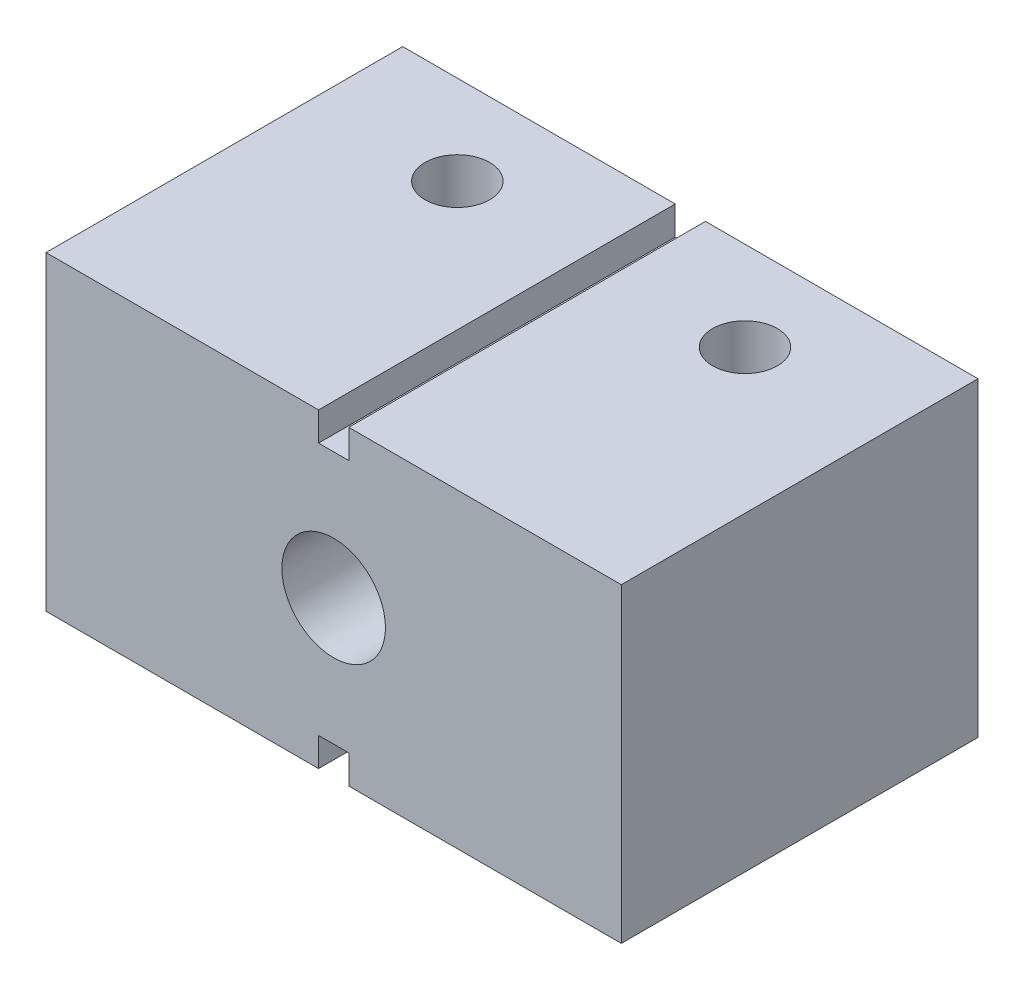
from build123d import *

# Parameters (mm, degrees)
SKETCH1_W           = 40
SKETCH1_H           = 21.6
SKETCH1_R           = 3.6
BOSS_EXTRUDE1_DEPTH = 24.8
CUT_EXTRUDE1_REACH  = 40.492
SKETCH2_R           = 2.25
SKETCH3_W           = 2.1
SKETCH3_H           = 24.8
CUT_EXTRUDE2_DEPTH  = 2
SKETCH4_W           = 2.1
SKETCH4_H           = 24.8
CUT_EXTRUDE3_DEPTH  = 2
CUT_EXTRUDE4_DEPTH  = 1.2


with BuildPart() as part:
    # Sketch1 → Boss-Extrude1 (new body)
    with BuildSketch(Plane.XY):
        Rectangle(SKETCH1_W, SKETCH1_H)
        with Locations(Location((0, 0, 0), (0, 0, 180))):
            Circle(SKETCH1_R, mode=Mode.SUBTRACT)
    extrude(amount=BOSS_EXTRUDE1_DEPTH)

    # Sketch2 → Cut-Extrude1 (cut, up to next)
    with BuildSketch(Plane(origin=(0, 10.8, 0), x_dir=(1, 0, 0), z_dir=(0, 1, 0)), mode=Mode.PRIVATE) as cut_extrude1_sk1:
        with Locations(Location((-10, -6.2, 0), (0, 0, 270))):
            Circle(SKETCH2_R)
    cut_extrude1_tool1 = extrude(cut_extrude1_sk1.sketch, amount=-CUT_EXTRUDE1_REACH, mode=Mode.PRIVATE) & part.part
    # Sketch2 → Cut-Extrude1 (cut, up to next)
    with BuildSketch(Plane(origin=(0, 10.8, 0), x_dir=(1, 0, 0), z_dir=(0, 1, 0)), mode=Mode.PRIVATE) as cut_extrude1_sk2:
        with Locations(Location((10, -6.2, 0), (0, 0, 270))):
            Circle(SKETCH2_R)
    cut_extrude1_tool2 = extrude(cut_extrude1_sk2.sketch, amount=-CUT_EXTRUDE1_REACH, mode=Mode.PRIVATE) & part.part
    add(cut_extrude1_tool1.solids().sort_by_distance((-10, 10.8, 6.2))[0], mode=Mode.SUBTRACT)
    add(cut_extrude1_tool2.solids().sort_by_distance((10, 10.8, 6.2))[0], mode=Mode.SUBTRACT)

    # Sketch3 → Cut-Extrude2 (cut)
    with BuildSketch(Plane(origin=(0, 10.8, 0), x_dir=(1, 0, 0), z_dir=(0, 1, 0))):
        with Locations((0, -12.4)):
            Rectangle(SKETCH3_W, SKETCH3_H)
    extrude(amount=-CUT_EXTRUDE2_DEPTH, mode=Mode.SUBTRACT)

    # Sketch4 → Cut-Extrude3 (cut)
    with BuildSketch(Plane.XZ.offset(10.8)):
        with Locations((0, 12.4)):
            Rectangle(SKETCH4_W, SKETCH4_H)
    extrude(amount=-CUT_EXTRUDE3_DEPTH, mode=Mode.SUBTRACT)

    # Sketch5 → Cut-Extrude4 (cut)
    # profile 1 of 4: a face of its own
    with BuildSketch(Plane(origin=(0, 0, 0), x_dir=(-1, 0, 0), z_dir=(0, 0, -1))):
        Polygon((-11.796693013, -7.110777244), (-11.796693013, -6.349358974), (-8.296693013, -6.349358974), (-8.296693013, -6.798076923), (-11.392846859, -6.798076923), (-11.392846859, -7.336538462), align=None)
    # profile 2 of 4: a face of its own
    with BuildSketch(Plane(origin=(0, 0, 0), x_dir=(-1, 0, 0), z_dir=(0, 0, -1))):
        with BuildLine():
            add(Edge.make_bspline(
                [(-10.221973462, -3.337339744), (-10.209139303, -3.310569467), (-10.183958379, -3.258045548), (-10.14251948, -3.182783944), (-10.098513171, -3.112776733), (-10.051821961, -3.047762395), (-10.003089069, -2.987431171), (-9.951157902, -2.932431575), (-9.895913818, -2.883501755), (-9.839548231, -2.838257605), (-9.7803361, -2.799198714), (-9.719814355, -2.764478144), (-9.657513241, -2.735021293), (-9.593506651, -2.711012891), (-9.527969979, -2.692938504), (-9.461249543, -2.679374079), (-9.39272898, -2.671628609), (-9.34652471, -2.670462234), (-9.323135321, -2.669871795)],
                knots=[0, 0, 0, 0, 1.199852352, 2.35413882, 3.47065844, 4.540274002, 5.587801972, 6.603495342, 7.593560922, 8.568777743, 9.522481312, 10.457521451, 11.387201504, 12.30490139, 13.21713931, 14.132356092, 15.05456678, 16, 16, 16, 16], degree=3))
            add(Edge.make_bspline(
                [(-9.323135321, -2.669871795), (-9.290138084, -2.670620849), (-9.224570496, -2.672109268), (-9.127351862, -2.685899195), (-9.032391056, -2.708483604), (-8.939680998, -2.739371961), (-8.848906805, -2.778918626), (-8.760975531, -2.828240437), (-8.674822483, -2.885835184), (-8.620733307, -2.929998384), (-8.593267532, -2.952423878)],
                knots=[0, 0, 0, 0, 0.989668167, 1.966532972, 2.939463265, 3.915194743, 4.894949873, 5.905734453, 6.936559411, 8, 8, 8, 8], degree=3))
            add(Edge.make_bspline(
                [(-8.593267532, -2.952423878), (-8.562289446, -2.980847606), (-8.500391893, -3.037641274), (-8.422362386, -3.137136721), (-8.354757328, -3.244911895), (-8.300925389, -3.36352948), (-8.257909904, -3.491462679), (-8.228179245, -3.629504314), (-8.210637897, -3.777190102), (-8.208204463, -3.87878994), (-8.206949423, -3.931189904)],
                knots=[0, 0, 0, 0, 0.926996352, 1.852238525, 2.781645049, 3.73067391, 4.721265738, 5.756811539, 6.843078903, 8, 8, 8, 8], degree=3))
            add(Edge.make_bspline(
                [(-8.206949423, -3.931189904), (-8.20809768, -3.979137537), (-8.21032759, -4.072251681), (-8.225492424, -4.207511232), (-8.252224883, -4.333778244), (-8.289148029, -4.45139135), (-8.336948958, -4.56013024), (-8.395535325, -4.660096145), (-8.465261687, -4.750766173), (-8.5447029, -4.831967285), (-8.630492714, -4.902913032), (-8.718385085, -4.96626001), (-8.809088088, -5.018948013), (-8.902119486, -5.061941442), (-8.997171623, -5.095706351), (-9.094421751, -5.120796409), (-9.194188394, -5.134749761), (-9.261396562, -5.136795107), (-9.295090449, -5.137820513)],
                knots=[0, 0, 0, 0, 1.265004079, 2.45663372, 3.584954987, 4.665300477, 5.703324836, 6.712186938, 7.714849438, 8.713389218, 9.702614074, 10.648777578, 11.568864218, 12.465490505, 13.348959921, 14.226816935, 15.111039146, 16, 16, 16, 16], degree=3))
            add(Edge.make_bspline(
                [(-9.295090449, -5.137820513), (-9.319881832, -5.137232341), (-9.368882712, -5.136069801), (-9.441581231, -5.128283083), (-9.512104778, -5.11497852), (-9.581017527, -5.096501138), (-9.648039239, -5.073048741), (-9.712876294, -5.042989025), (-9.776017355, -5.00877782), (-9.837298762, -4.969332362), (-9.896228951, -4.924682211), (-9.951780497, -4.873721957), (-10.004475348, -4.817440416), (-10.054147546, -4.755802221), (-10.100612436, -4.68869594), (-10.144048697, -4.61627477), (-10.184729874, -4.538514921), (-10.208948136, -4.484047527), (-10.22127234, -4.456330128)],
                knots=[0, 0, 0, 0, 0.970998584, 1.919206541, 2.85996215, 3.779229183, 4.711484757, 5.637246212, 6.575281256, 7.522383947, 8.489058119, 9.467492802, 10.471290689, 11.506323461, 12.565206568, 13.665688042, 14.812113961, 16, 16, 16, 16], degree=3))
            add(Edge.make_bspline(
                [(-10.22127234, -4.456330128), (-10.238111181, -4.49433646), (-10.271126397, -4.568853895), (-10.339991583, -4.669054243), (-10.42191297, -4.75595456), (-10.515921539, -4.828925848), (-10.618725862, -4.885787283), (-10.726509226, -4.928168038), (-10.838974973, -4.953339285), (-10.915494214, -4.956663126), (-10.953944615, -4.958333333)],
                knots=[0, 0, 0, 0, 1.055786149, 2.070036037, 3.075322791, 4.083892423, 5.084738157, 6.054218916, 7.022258148, 8, 8, 8, 8], degree=3))
            add(Edge.make_bspline(
                [(-10.953944615, -4.958333333), (-10.993118725, -4.95677113), (-11.071628713, -4.953640271), (-11.188072958, -4.926183921), (-11.302290252, -4.882268218), (-11.413216399, -4.82188178), (-11.518271697, -4.747264885), (-11.611164276, -4.656040071), (-11.693389143, -4.552964295), (-11.762217123, -4.437457762), (-11.81720313, -4.313275646), (-11.857602218, -4.183272638), (-11.882277156, -4.048281642), (-11.88504002, -3.956533472), (-11.886436603, -3.91015625)],
                knots=[0, 0, 0, 0, 0.906232073, 1.81620639, 2.755067393, 3.733488311, 4.733923586, 5.729132781, 6.738430927, 7.779927963, 8.833993065, 9.876600597, 10.92665582, 12, 12, 12, 12], degree=3))
            add(Edge.make_bspline(
                [(-11.886436603, -3.91015625), (-11.884881568, -3.861664068), (-11.881817257, -3.766106636), (-11.85560527, -3.625940261), (-11.813429595, -3.491656802), (-11.75476625, -3.364768159), (-11.682146313, -3.248184184), (-11.598508489, -3.144118004), (-11.503816305, -3.054641595), (-11.398980087, -2.981654002), (-11.289102314, -2.922301241), (-11.175331868, -2.881212893), (-11.06060845, -2.854174129), (-10.983304808, -2.850959117), (-10.944830032, -2.849358974)],
                knots=[0, 0, 0, 0, 1.110208671, 2.1877483, 3.254592481, 4.327866721, 5.381256925, 6.393920549, 7.378769384, 8.35475804, 9.312870313, 10.230979168, 11.119541109, 12, 12, 12, 12], degree=3))
            add(Edge.make_bspline(
                [(-10.944830032, -2.849358974), (-10.906846781, -2.851040096), (-10.831987493, -2.854353336), (-10.72231246, -2.878853712), (-10.618190924, -2.920127929), (-10.520223618, -2.977220018), (-10.429467873, -3.047886471), (-10.349363446, -3.132551883), (-10.27765267, -3.228476846), (-10.240816344, -3.300498509), (-10.221973462, -3.337339744)],
                knots=[0, 0, 0, 0, 0.988899786, 1.948973104, 2.910993775, 3.895630921, 4.893001336, 5.896206921, 6.923846912, 8, 8, 8, 8], degree=3))
        make_face()
        with BuildLine():
            add(Edge.make_bspline(
                [(-11.482590449, -3.927684295), (-11.482241652, -3.947568767), (-11.481554087, -3.986765997), (-11.474476286, -4.044293835), (-11.462257884, -4.099543981), (-11.446270013, -4.152575415), (-11.426249272, -4.203721316), (-11.399464918, -4.251473342), (-11.369678701, -4.297705843), (-11.335537215, -4.341262609), (-11.2970584, -4.380079862), (-11.256284594, -4.414644644), (-11.213379956, -4.44457262), (-11.16760837, -4.468416243), (-11.119310674, -4.486741615), (-11.068831547, -4.500149414), (-11.015880013, -4.507869972), (-10.979910497, -4.509027813), (-10.961656955, -4.509615385)],
                knots=[0, 0, 0, 0, 1.095042298, 2.158600232, 3.186412038, 4.208725755, 5.208081626, 6.204780072, 7.21895422, 8.236392009, 9.246963976, 10.224519195, 11.178039528, 12.122476845, 13.059778917, 14.018500309, 14.994443309, 16, 16, 16, 16], degree=3))
            add(Edge.make_bspline(
                [(-10.961656955, -4.509615385), (-10.943168111, -4.509070287), (-10.906695216, -4.507994973), (-10.852918351, -4.499631361), (-10.801515228, -4.484271993), (-10.751248585, -4.465108355), (-10.703415283, -4.4384835), (-10.65702449, -4.407000073), (-10.612664677, -4.369588896), (-10.571249567, -4.326844887), (-10.532095063, -4.281467155), (-10.498603755, -4.233101268), (-10.470422296, -4.18339587), (-10.446211164, -4.133067842), (-10.427732081, -4.080670563), (-10.415504146, -4.026747143), (-10.40736939, -3.971631128), (-10.406237864, -3.934490686), (-10.405667372, -3.915765224)],
                knots=[0, 0, 0, 0, 0.988185248, 1.949390515, 2.89834022, 3.851801922, 4.818915382, 5.816844422, 6.845348625, 7.91425703, 8.995576874, 10.04563024, 11.052821543, 12.047539407, 13.027398105, 14.015267437, 14.999337865, 16, 16, 16, 16], degree=3))
            add(Edge.make_bspline(
                [(-10.405667372, -3.915765224), (-10.406621219, -3.888826316), (-10.408526611, -3.835013521), (-10.423565383, -3.755773928), (-10.448655471, -3.678917059), (-10.482545826, -3.605335888), (-10.525205301, -3.536824764), (-10.575083492, -3.474991681), (-10.633056114, -3.422214848), (-10.696933345, -3.378514067), (-10.763495046, -3.342498317), (-10.831822973, -3.317526694), (-10.900082386, -3.300716541), (-10.945902713, -3.298953083), (-10.968668173, -3.298076923)],
                knots=[0, 0, 0, 0, 1.049057894, 2.095583739, 3.129316217, 4.192621495, 5.243692748, 6.26617574, 7.278021799, 8.285803791, 9.275614543, 10.217703439, 11.114480347, 12, 12, 12, 12], degree=3))
            add(Edge.make_bspline(
                [(-10.968668173, -3.298076923), (-11.000019564, -3.299858116), (-11.062803753, -3.303425126), (-11.154134486, -3.336399063), (-11.242032528, -3.386673495), (-11.309506946, -3.444624703), (-11.359642226, -3.499400731), (-11.3926366, -3.546872098), (-11.420815483, -3.59877246), (-11.4431817, -3.655908135), (-11.461366225, -3.717057771), (-11.47410644, -3.783265526), (-11.480677647, -3.853931928), (-11.481941575, -3.9026655), (-11.482590449, -3.927684295)],
                knots=[0, 0, 0, 0, 1.240891064, 2.485004192, 3.810825972, 5.246005007, 5.995001394, 6.754385943, 7.534904256, 8.334385291, 9.185808003, 10.064745552, 11.006480914, 12, 12, 12, 12], degree=3))
        make_face(mode=Mode.SUBTRACT)
        with BuildLine():
            add(Edge.make_bspline(
                [(-10.001821218, -3.908052885), (-10.001116596, -3.934261767), (-9.999721281, -3.986161451), (-9.98958071, -4.062375096), (-9.974006181, -4.136165695), (-9.949190932, -4.206306975), (-9.920470073, -4.274705456), (-9.883308825, -4.339368109), (-9.840475663, -4.40156218), (-9.790936979, -4.459807983), (-9.737105313, -4.513229428), (-9.679542632, -4.560143475), (-9.619584576, -4.600147899), (-9.556337284, -4.632816591), (-9.490535193, -4.658204334), (-9.421494821, -4.675445387), (-9.350190211, -4.687360713), (-9.301450198, -4.68851848), (-9.276861282, -4.689102564)],
                knots=[0, 0, 0, 0, 1.061897617, 2.102804347, 3.111672779, 4.112102386, 5.113293953, 6.114261473, 7.128451447, 8.170219712, 9.208364724, 10.198019986, 11.175268719, 12.124198868, 13.077609243, 14.026397567, 15.004334584, 16, 16, 16, 16], degree=3))
            add(Edge.make_bspline(
                [(-9.276861282, -4.689102564), (-9.245907371, -4.687933982), (-9.184576975, -4.685618618), (-9.094960428, -4.665749844), (-9.0087651, -4.634917556), (-8.928056845, -4.590605724), (-8.853930066, -4.536000242), (-8.788164103, -4.473074029), (-8.733372631, -4.40063402), (-8.688466969, -4.320372501), (-8.653495875, -4.23212498), (-8.628197444, -4.136865389), (-8.613450873, -4.034482867), (-8.611697425, -3.963957517), (-8.610795577, -3.927684295)],
                knots=[0, 0, 0, 0, 0.9814525, 1.944596565, 2.899679746, 3.878886998, 4.855139527, 5.815164808, 6.757283047, 7.727088608, 8.725770639, 9.762198929, 10.849034367, 12, 12, 12, 12], degree=3))
            add(Edge.make_bspline(
                [(-8.610795577, -3.927684295), (-8.611484676, -3.897273993), (-8.612829493, -3.837926482), (-8.622803821, -3.75163874), (-8.638696487, -3.670106285), (-8.661987723, -3.593646891), (-8.691264599, -3.52151542), (-8.728048036, -3.454694127), (-8.770969077, -3.392599233), (-8.820069277, -3.335914666), (-8.873602604, -3.285513256), (-8.929450679, -3.240654278), (-8.987296882, -3.20275684), (-9.047835533, -3.172206317), (-9.110385115, -3.148462731), (-9.174830326, -3.130562719), (-9.241736806, -3.12074493), (-9.286880838, -3.119315761), (-9.309814006, -3.118589744)],
                knots=[0, 0, 0, 0, 1.222281775, 2.385355485, 3.487203028, 4.557186295, 5.593560507, 6.611067706, 7.617058548, 8.622873886, 9.619741804, 10.569077626, 11.499394282, 12.39435997, 13.28947359, 14.185178695, 15.078070757, 16, 16, 16, 16], degree=3))
            add(Edge.make_bspline(
                [(-9.309814006, -3.118589744), (-9.331838015, -3.119178311), (-9.375710101, -3.120350744), (-9.440224323, -3.132409086), (-9.503446096, -3.149622659), (-9.564803412, -3.175267661), (-9.624372811, -3.208386568), (-9.682121455, -3.248598297), (-9.737675593, -3.296105183), (-9.790973053, -3.349467041), (-9.840699788, -3.407605481), (-9.883317735, -3.470452588), (-9.920276236, -3.535656503), (-9.949506891, -3.60454394), (-9.973970795, -3.675773099), (-9.989518546, -3.750707005), (-9.999793225, -3.82830671), (-10.001136855, -3.881141862), (-10.001821218, -3.908052885)],
                knots=[0, 0, 0, 0, 0.909659226, 1.812051987, 2.705396151, 3.615260672, 4.55387093, 5.51892194, 6.519929187, 7.572237699, 8.635098036, 9.677778311, 10.707435555, 11.728897661, 12.767899407, 13.81607327, 14.887640164, 16, 16, 16, 16], degree=3))
        make_face(mode=Mode.SUBTRACT)
    # profile 3 of 4: a face of its own
    with BuildSketch(Plane(origin=(0, 0, 0), x_dir=(-1, 0, 0), z_dir=(0, 0, -1))):
        with BuildLine():
            Line((-10.899257115, -0.78525641), (-10.899257115, -0.336538462))
            Line((-10.899257115, -0.336538462), (-10.462458237, -0.336538462))
            add(Edge.make_bspline(
                [(-10.462458237, -0.336538462), (-10.481254419, -0.332228906), (-10.517928783, -0.323820274), (-10.570264571, -0.305304283), (-10.618659937, -0.282683929), (-10.664271272, -0.256938569), (-10.705329375, -0.225653829), (-10.743912506, -0.191432773), (-10.777434348, -0.151813781), (-10.796912476, -0.123110334), (-10.806709038, -0.108673878)],
                knots=[0, 0, 0, 0, 1.08898891, 2.124791909, 3.129224238, 4.105481065, 5.077441123, 6.040388005, 7.014409297, 8, 8, 8, 8], degree=3))
            add(Edge.make_bspline(
                [(-10.806709038, -0.108673878), (-10.827995774, -0.065220291), (-10.870025652, 0.020577224), (-10.911775694, 0.156274887), (-10.939592038, 0.293562365), (-10.942614414, 0.386181311), (-10.94412891, 0.432592147)],
                knots=[0, 0, 0, 0, 1.028471117, 2.030678542, 3.013184023, 4, 4, 4, 4], degree=3))
            add(Edge.make_bspline(
                [(-10.94412891, 0.432592147), (-10.943258392, 0.466773107), (-10.941532088, 0.534556582), (-10.925437494, 0.634922913), (-10.89956614, 0.73239989), (-10.863859848, 0.82606818), (-10.820048596, 0.913451078), (-10.770543805, 0.993233652), (-10.714422948, 1.06346164), (-10.652975304, 1.125038055), (-10.584083874, 1.176203873), (-10.508647318, 1.216551381), (-10.42572553, 1.245174983), (-10.367532305, 1.254915519), (-10.337658558, 1.259915865)],
                knots=[0, 0, 0, 0, 1.099015544, 2.179432478, 3.260947688, 4.338981182, 5.398181099, 6.40160478, 7.353922011, 8.284349489, 9.192639792, 10.104191918, 11.026778618, 12, 12, 12, 12], degree=3))
            add(Edge.make_bspline(
                [(-10.337658558, 1.259915865), (-10.360680398, 1.268014601), (-10.406203908, 1.284029082), (-10.471788094, 1.313313771), (-10.533002919, 1.348788048), (-10.590666323, 1.388904846), (-10.64513327, 1.433673519), (-10.694507773, 1.484690584), (-10.741545279, 1.539342047), (-10.782777914, 1.599609729), (-10.820602081, 1.662298924), (-10.853576567, 1.7269834), (-10.881836521, 1.792688974), (-10.904042731, 1.859945135), (-10.92273276, 1.927888477), (-10.935303752, 1.997568999), (-10.9421482, 2.068405079), (-10.943467411, 2.115971975), (-10.94412891, 2.139823718)],
                knots=[0, 0, 0, 0, 1.024672991, 2.026193794, 3.01103273, 3.991165591, 4.973850373, 5.96628909, 6.969107479, 7.9982829, 9.028393851, 10.042340945, 11.044967205, 12.028827566, 13.014448664, 14.002022455, 14.998142625, 16, 16, 16, 16], degree=3))
            add(Edge.make_bspline(
                [(-10.94412891, 2.139823718), (-10.943811958, 2.164150027), (-10.943188853, 2.211973905), (-10.935671015, 2.282427493), (-10.924828875, 2.350701399), (-10.908498214, 2.416461513), (-10.888303462, 2.480124101), (-10.862721949, 2.541084669), (-10.833603927, 2.600264962), (-10.787570185, 2.674422482), (-10.722586814, 2.760250435), (-10.629980596, 2.848017145), (-10.526610053, 2.921306637), (-10.430355226, 2.968964978), (-10.345871365, 2.999320508), (-10.274958075, 3.019717854), (-10.19685411, 3.036110066), (-10.111982925, 3.050297442), (-10.019738766, 3.060469013), (-9.920589108, 3.067997783), (-9.81420873, 3.07318971), (-9.74101047, 3.073537849), (-9.703143333, 3.073717949)],
                knots=[0, 0, 0, 0, 0.823332918, 1.618616861, 2.396586156, 3.162386254, 3.910649777, 4.655726331, 5.398909421, 6.1412916, 7.608533871, 9.030212322, 10.444139297, 11.884503253, 12.650507755, 13.48205207, 14.380733726, 15.351243431, 16.394668736, 17.521733916, 18.717936206, 20, 20, 20, 20], degree=3))
            Line((-9.703143333, 3.073717949), (-8.296693013, 3.073717949))
            Line((-8.296693013, 3.073717949), (-8.296693013, 2.625))
            Line((-8.296693013, 2.625), (-9.70174109, 2.625))
            add(Edge.make_bspline(
                [(-9.70174109, 2.625), (-9.733060554, 2.624943821), (-9.793142877, 2.624836048), (-9.879163541, 2.621874148), (-9.957239077, 2.617713708), (-10.027442399, 2.612467552), (-10.089875837, 2.604714797), (-10.144615475, 2.595667342), (-10.191710833, 2.585798641), (-10.243196469, 2.568798611), (-10.299467422, 2.542233989), (-10.35959579, 2.500751636), (-10.412413403, 2.449707016), (-10.458145994, 2.390106135), (-10.494533967, 2.32233864), (-10.521621568, 2.248088902), (-10.536916668, 2.167085006), (-10.539138583, 2.111140367), (-10.540282756, 2.082331731)],
                knots=[0, 0, 0, 0, 1.305595988, 2.50461634, 3.587666171, 4.565077188, 5.438800553, 6.209235777, 6.878175067, 7.442006767, 8.466179135, 9.460727197, 10.473669419, 11.516214057, 12.579940716, 13.667887689, 14.799081087, 16, 16, 16, 16], degree=3))
            add(Edge.make_bspline(
                [(-10.540282756, 2.082331731), (-10.538806528, 2.050172886), (-10.535848027, 1.985723529), (-10.511503084, 1.891113072), (-10.47316402, 1.799404852), (-10.419893854, 1.712063965), (-10.352685597, 1.631632232), (-10.272642636, 1.560437941), (-10.179102603, 1.501687471), (-10.09215158, 1.460202068), (-10.012649235, 1.433419397), (-9.942164422, 1.416508462), (-9.862262483, 1.400730981), (-9.772236629, 1.38967139), (-9.672479786, 1.379301941), (-9.562727465, 1.373861271), (-9.443066843, 1.369210847), (-9.360066988, 1.368802491), (-9.316825224, 1.368589744)],
                knots=[0, 0, 0, 0, 0.965918169, 1.935791113, 2.918614482, 3.946728758, 4.999527746, 6.059992734, 7.153658271, 8.310614728, 8.948450525, 9.672867845, 10.488828659, 11.396296474, 12.399093975, 13.50428262, 14.699766169, 16, 16, 16, 16], degree=3))
            Line((-9.316825224, 1.368589744), (-8.296693013, 1.368589744))
            Line((-8.296693013, 1.368589744), (-8.296693013, 0.919871795))
            Line((-8.296693013, 0.919871795), (-9.616905353, 0.919871795))
            add(Edge.make_bspline(
                [(-9.616905353, 0.919871795), (-9.652197643, 0.919818108), (-9.719756655, 0.919715336), (-9.816524849, 0.916732275), (-9.904183696, 0.912612076), (-9.983017624, 0.907306379), (-10.05271427, 0.899700824), (-10.113502559, 0.890506882), (-10.165281576, 0.880790494), (-10.221077388, 0.863821517), (-10.282208638, 0.837870141), (-10.347041093, 0.796261859), (-10.404107254, 0.744679031), (-10.453052143, 0.684554785), (-10.492650508, 0.616565861), (-10.519858428, 0.541467734), (-10.537376235, 0.46074255), (-10.539295872, 0.404642361), (-10.540282756, 0.375801282)],
                knots=[0, 0, 0, 0, 1.376758737, 2.635489419, 3.77647752, 4.80022883, 5.717469035, 6.510473873, 7.19888343, 7.770014609, 8.782826871, 9.779297374, 10.760594766, 11.771599753, 12.792790105, 13.814021158, 14.876189361, 16, 16, 16, 16], degree=3))
            add(Edge.make_bspline(
                [(-10.540282756, 0.375801282), (-10.538657887, 0.345073774), (-10.535393175, 0.283335583), (-10.513054609, 0.191702679), (-10.47449279, 0.102656922), (-10.424212986, 0.015081744), (-10.35834883, -0.065732195), (-10.279282974, -0.137710489), (-10.187177433, -0.198690187), (-10.100763637, -0.240913005), (-10.023154366, -0.26866124), (-9.956200841, -0.286389334), (-9.881929978, -0.302839556), (-9.799654901, -0.314950456), (-9.709846862, -0.324745123), (-9.612317625, -0.331567904), (-9.507101036, -0.335808637), (-9.434384334, -0.336289574), (-9.396753109, -0.336538462)],
                knots=[0, 0, 0, 0, 0.973894388, 1.956763917, 2.96941869, 4.041797769, 5.147885003, 6.25966368, 7.418502335, 8.637782007, 9.298570163, 10.028234491, 10.831780649, 11.70874194, 12.662651334, 13.69505766, 14.807181832, 16, 16, 16, 16], degree=3))
            Line((-9.396753109, -0.336538462), (-8.296693013, -0.336538462))
            Line((-8.296693013, -0.336538462), (-8.296693013, -0.78525641))
            Line((-8.296693013, -0.78525641), (-10.899257115, -0.78525641))
        make_face()
    # profile 4 of 4: a face of its own
    with BuildSketch(Plane(origin=(0, 0, 0), x_dir=(-1, 0, 0), z_dir=(0, 0, -1))):
        with BuildLine():
            Line((-10.899257115, 3.791666667), (-10.899257115, 4.240384615))
            Line((-10.899257115, 4.240384615), (-10.462458237, 4.240384615))
            add(Edge.make_bspline(
                [(-10.462458237, 4.240384615), (-10.481254419, 4.244694171), (-10.517928783, 4.253102803), (-10.570264571, 4.271618794), (-10.618659937, 4.294239147), (-10.664271272, 4.319984508), (-10.705329375, 4.351269248), (-10.743912506, 4.385490304), (-10.777434348, 4.425109296), (-10.796912476, 4.453812743), (-10.806709038, 4.468249199)],
                knots=[0, 0, 0, 0, 1.08898891, 2.124791909, 3.129224238, 4.105481065, 5.077441123, 6.040388005, 7.014409297, 8, 8, 8, 8], degree=3))
            add(Edge.make_bspline(
                [(-10.806709038, 4.468249199), (-10.827995774, 4.511702786), (-10.870025652, 4.597500301), (-10.911775694, 4.733197964), (-10.939592038, 4.870485442), (-10.942614414, 4.963104388), (-10.94412891, 5.009515224)],
                knots=[0, 0, 0, 0, 1.028471117, 2.030678542, 3.013184023, 4, 4, 4, 4], degree=3))
            add(Edge.make_bspline(
                [(-10.94412891, 5.009515224), (-10.943258392, 5.043696184), (-10.941532088, 5.111479659), (-10.925437494, 5.21184599), (-10.89956614, 5.309322967), (-10.863859848, 5.402991257), (-10.820048596, 5.490374155), (-10.770543805, 5.570156729), (-10.714422948, 5.640384717), (-10.652975304, 5.701961132), (-10.584083874, 5.75312695), (-10.508647318, 5.793474458), (-10.42572553, 5.82209806), (-10.367532305, 5.831838596), (-10.337658558, 5.836838942)],
                knots=[0, 0, 0, 0, 1.099015544, 2.179432478, 3.260947688, 4.338981182, 5.398181099, 6.40160478, 7.353922011, 8.284349489, 9.192639792, 10.104191918, 11.026778618, 12, 12, 12, 12], degree=3))
            add(Edge.make_bspline(
                [(-10.337658558, 5.836838942), (-10.360680398, 5.844937677), (-10.406203908, 5.860952159), (-10.471788094, 5.890236847), (-10.533002919, 5.925711125), (-10.590666323, 5.965827923), (-10.64513327, 6.010596596), (-10.694507773, 6.061613661), (-10.741545279, 6.116265124), (-10.782777914, 6.176532806), (-10.820602081, 6.239222001), (-10.853576567, 6.303906477), (-10.881836521, 6.369612051), (-10.904042731, 6.436868212), (-10.92273276, 6.504811554), (-10.935303752, 6.574492076), (-10.9421482, 6.645328155), (-10.943467411, 6.692895052), (-10.94412891, 6.716746795)],
                knots=[0, 0, 0, 0, 1.024672991, 2.026193794, 3.01103273, 3.991165591, 4.973850373, 5.96628909, 6.969107479, 7.9982829, 9.028393851, 10.042340945, 11.044967205, 12.028827566, 13.014448664, 14.002022455, 14.998142625, 16, 16, 16, 16], degree=3))
            add(Edge.make_bspline(
                [(-10.94412891, 6.716746795), (-10.943811958, 6.741073104), (-10.943188853, 6.788896982), (-10.935671015, 6.85935057), (-10.924828875, 6.927624475), (-10.908498214, 6.99338459), (-10.888303462, 7.057047178), (-10.862721949, 7.118007746), (-10.833603927, 7.177188039), (-10.787570185, 7.251345559), (-10.722586814, 7.337173512), (-10.629980596, 7.424940221), (-10.526610053, 7.498229714), (-10.430355226, 7.545888054), (-10.345871365, 7.576243585), (-10.274958075, 7.596640931), (-10.19685411, 7.613033143), (-10.111982925, 7.627220519), (-10.019738766, 7.63739209), (-9.920589108, 7.64492086), (-9.81420873, 7.650112787), (-9.74101047, 7.650460925), (-9.703143333, 7.650641026)],
                knots=[0, 0, 0, 0, 0.823332918, 1.618616861, 2.396586156, 3.162386254, 3.910649777, 4.655726331, 5.398909421, 6.1412916, 7.608533871, 9.030212322, 10.444139297, 11.884503253, 12.650507755, 13.48205207, 14.380733726, 15.351243431, 16.394668736, 17.521733916, 18.717936206, 20, 20, 20, 20], degree=3))
            Line((-9.703143333, 7.650641026), (-8.296693013, 7.650641026))
            Line((-8.296693013, 7.650641026), (-8.296693013, 7.201923077))
            Line((-8.296693013, 7.201923077), (-9.70174109, 7.201923077))
            add(Edge.make_bspline(
                [(-9.70174109, 7.201923077), (-9.733060554, 7.201866898), (-9.793142877, 7.201759125), (-9.879163541, 7.198797225), (-9.957239077, 7.194636785), (-10.027442399, 7.189390628), (-10.089875837, 7.181637874), (-10.144615475, 7.172590419), (-10.191710833, 7.162721718), (-10.243196469, 7.145721688), (-10.299467422, 7.119157066), (-10.35959579, 7.077674713), (-10.412413403, 7.026630093), (-10.458145994, 6.967029212), (-10.494533967, 6.899261717), (-10.521621568, 6.825011979), (-10.536916668, 6.744008083), (-10.539138583, 6.688063444), (-10.540282756, 6.659254808)],
                knots=[0, 0, 0, 0, 1.305595988, 2.50461634, 3.587666171, 4.565077188, 5.438800553, 6.209235777, 6.878175067, 7.442006767, 8.466179135, 9.460727197, 10.473669419, 11.516214057, 12.579940716, 13.667887689, 14.799081087, 16, 16, 16, 16], degree=3))
            add(Edge.make_bspline(
                [(-10.540282756, 6.659254808), (-10.538806528, 6.627095963), (-10.535848027, 6.562646606), (-10.511503084, 6.468036149), (-10.47316402, 6.376327928), (-10.419893854, 6.288987042), (-10.352685597, 6.208555309), (-10.272642636, 6.137361018), (-10.179102603, 6.078610548), (-10.09215158, 6.037125145), (-10.012649235, 6.010342474), (-9.942164422, 5.993431539), (-9.862262483, 5.977654058), (-9.772236629, 5.966594466), (-9.672479786, 5.956225018), (-9.562727465, 5.950784347), (-9.443066843, 5.946133924), (-9.360066988, 5.945725568), (-9.316825224, 5.945512821)],
                knots=[0, 0, 0, 0, 0.965918169, 1.935791113, 2.918614482, 3.946728758, 4.999527746, 6.059992734, 7.153658271, 8.310614728, 8.948450525, 9.672867845, 10.488828659, 11.396296474, 12.399093975, 13.50428262, 14.699766169, 16, 16, 16, 16], degree=3))
            Line((-9.316825224, 5.945512821), (-8.296693013, 5.945512821))
            Line((-8.296693013, 5.945512821), (-8.296693013, 5.496794872))
            Line((-8.296693013, 5.496794872), (-9.616905353, 5.496794872))
            add(Edge.make_bspline(
                [(-9.616905353, 5.496794872), (-9.652197643, 5.496741185), (-9.719756655, 5.496638413), (-9.816524849, 5.493655352), (-9.904183696, 5.489535153), (-9.983017624, 5.484229456), (-10.05271427, 5.4766239), (-10.113502559, 5.467429959), (-10.165281576, 5.457713571), (-10.221077388, 5.440744594), (-10.282208638, 5.414793218), (-10.347041093, 5.373184936), (-10.404107254, 5.321602107), (-10.453052143, 5.261477862), (-10.492650508, 5.193488937), (-10.519858428, 5.118390811), (-10.537376235, 5.037665627), (-10.539295872, 4.981565438), (-10.540282756, 4.952724359)],
                knots=[0, 0, 0, 0, 1.376758737, 2.635489419, 3.77647752, 4.80022883, 5.717469035, 6.510473873, 7.19888343, 7.770014609, 8.782826871, 9.779297374, 10.760594766, 11.771599753, 12.792790105, 13.814021158, 14.876189361, 16, 16, 16, 16], degree=3))
            add(Edge.make_bspline(
                [(-10.540282756, 4.952724359), (-10.538657887, 4.921996851), (-10.535393175, 4.86025866), (-10.513054609, 4.768625756), (-10.47449279, 4.679579999), (-10.424212986, 4.592004821), (-10.35834883, 4.511190882), (-10.279282974, 4.439212588), (-10.187177433, 4.37823289), (-10.100763637, 4.336010072), (-10.023154366, 4.308261836), (-9.956200841, 4.290533743), (-9.881929978, 4.274083521), (-9.799654901, 4.261972621), (-9.709846862, 4.252177954), (-9.612317625, 4.245355173), (-9.507101036, 4.24111444), (-9.434384334, 4.240633503), (-9.396753109, 4.240384615)],
                knots=[0, 0, 0, 0, 0.973894388, 1.956763917, 2.96941869, 4.041797769, 5.147885003, 6.25966368, 7.418502335, 8.637782007, 9.298570163, 10.028234491, 10.831780649, 11.70874194, 12.662651334, 13.69505766, 14.807181832, 16, 16, 16, 16], degree=3))
            Line((-9.396753109, 4.240384615), (-8.296693013, 4.240384615))
            Line((-8.296693013, 4.240384615), (-8.296693013, 3.791666667))
            Line((-8.296693013, 3.791666667), (-10.899257115, 3.791666667))
        make_face()
    extrude(amount=-CUT_EXTRUDE4_DEPTH, mode=Mode.SUBTRACT)


solid = part.part
